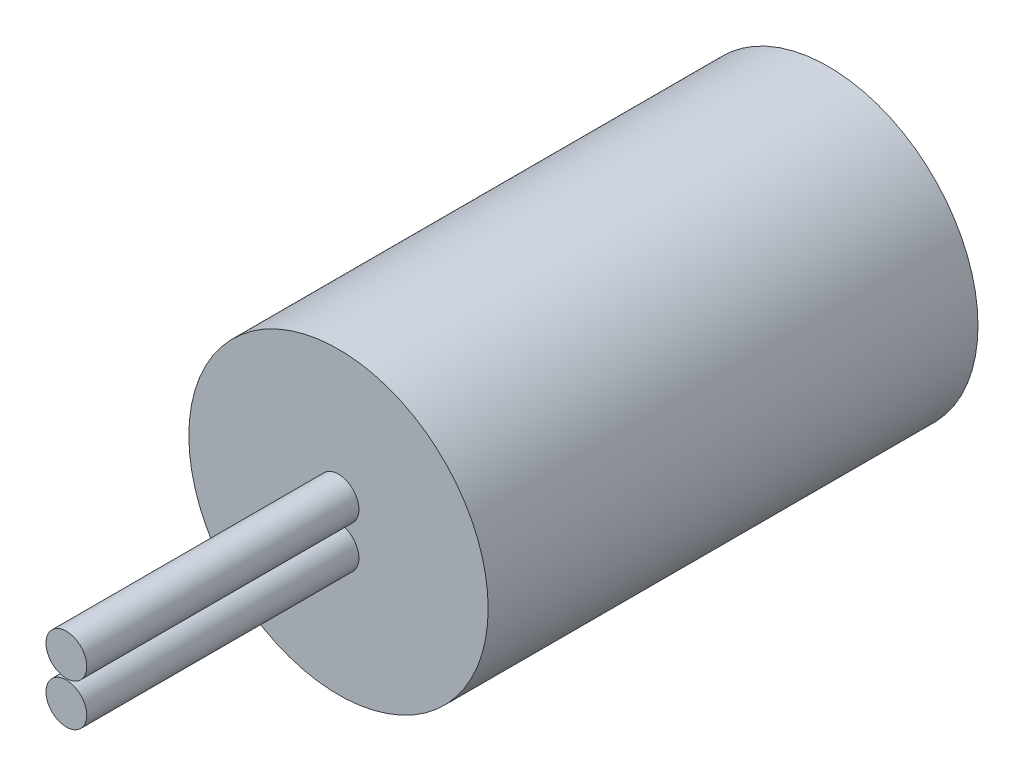
from build123d import *

# Parameters (mm, degrees)
SKETCH_1_R        = 5.5
EXTRUDE_311_DEPTH = 9
SKETCH_2_R        = 0.75
EXTRUDE_525_DEPTH = 10


with BuildPart() as part:
    # Эскиз1 → Extrude 311 (new, symmetric)
    with BuildSketch(Plane.XY):
        Circle(SKETCH_1_R)
    extrude(amount=EXTRUDE_311_DEPTH, both=True)

    # Эскиз2 → Extrude 525 (add)
    with BuildSketch(Plane.XY.offset(9)):
        with Locations((0, -0.775)):
            Circle(SKETCH_2_R)
        with Locations((0, 0.775)):
            Circle(SKETCH_2_R)
    extrude(amount=EXTRUDE_525_DEPTH)


solid = part.part
